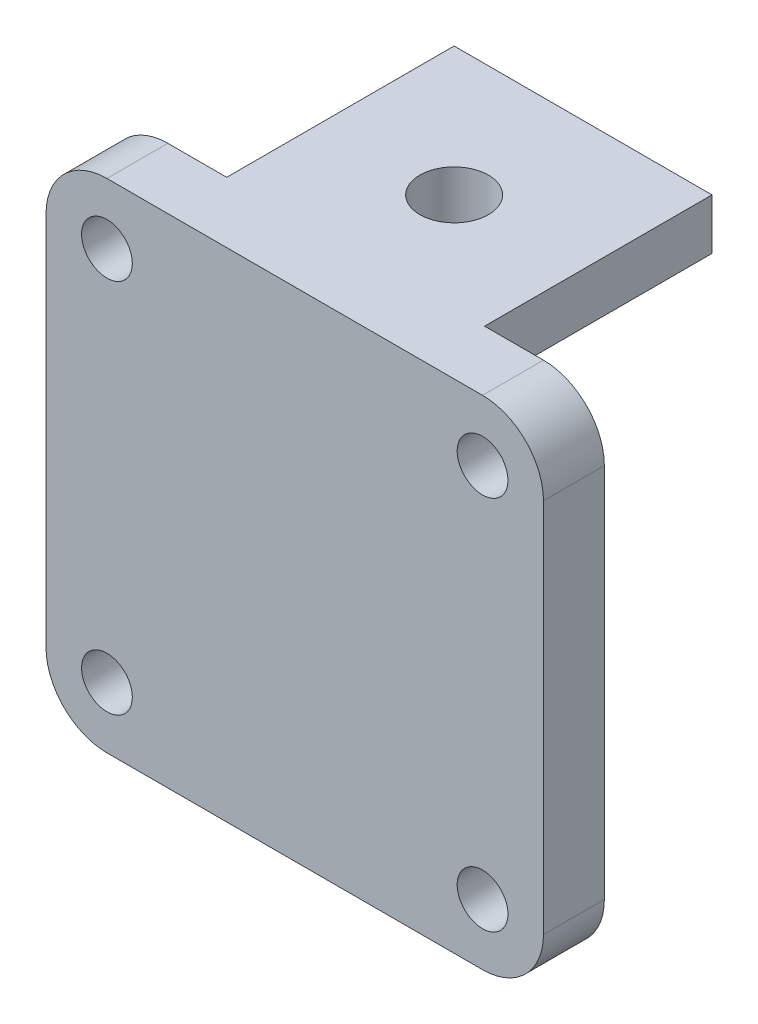
from build123d import *

# Parameters (mm, degrees)
SKETCH1_W               = 25.4
SKETCH1_H               = 25.4
BOSS_EXTRUDE1_DEPTH     = 5
F_1_4_CLEARANCE_HOLE1_D = 6.7564
SKETCH4_R               = 2.5
SKETCH4_W               = 25.4
SKETCH4_H               = 5
BOSS_EXTRUDE2_DEPTH     = 3
FILLET1_R               = 6


with BuildPart() as part:
    # Sketch1 → Boss-Extrude1 (new body)
    with BuildSketch(Plane(origin=(0, 0, 0), x_dir=(1, 0, 0), z_dir=(0, 1, 0))):
        Rectangle(SKETCH1_W, SKETCH1_H)
    extrude(amount=BOSS_EXTRUDE1_DEPTH)

    # 1/4 Clearance Hole1 (through all)
    with Locations(Plane(origin=(0, 5, 0), x_dir=(1, 0, 0), z_dir=(0, 1, 0))):
        with Locations((0, 0)):
            Hole(F_1_4_CLEARANCE_HOLE1_D / 2)

    # Sketch4 → Boss-Extrude2 (add, symmetric)
    # profile 1 of 2: a face of its own
    with BuildSketch(Plane.XY.offset(12.7)):
        Polygon((-24.5, 5), (-24.5, -44), (24.5, -44), (24.5, 5), (12.7, 5), (12.7, 0), (-12.7, 0), (-12.7, 5), align=None)
        with Locations((-18.5, -38)):
            Circle(SKETCH4_R, mode=Mode.SUBTRACT)
        with Locations((18.5, -38)):
            Circle(SKETCH4_R, mode=Mode.SUBTRACT)
        with Locations((-18.5, -1)):
            Circle(SKETCH4_R, mode=Mode.SUBTRACT)
        with Locations((18.5, -1)):
            Circle(SKETCH4_R, mode=Mode.SUBTRACT)
    # profile 2 of 2: a face of its own
    with BuildSketch(Plane.XY.offset(12.7)):
        with Locations((0, 2.5)):
            Rectangle(SKETCH4_W, SKETCH4_H)
    extrude(amount=BOSS_EXTRUDE2_DEPTH, both=True)

    # Fillet1
    fillet1_edges = [part.edges().sort_by_distance(p)[0] for p in [
        (-24.5, 5, 12.7),
        (24.5, 5, 12.7),
        (24.5, -44, 12.7),
        (-24.5, -44, 12.7),
    ]]
    fillet(fillet1_edges, radius=FILLET1_R)


solid = part.part
